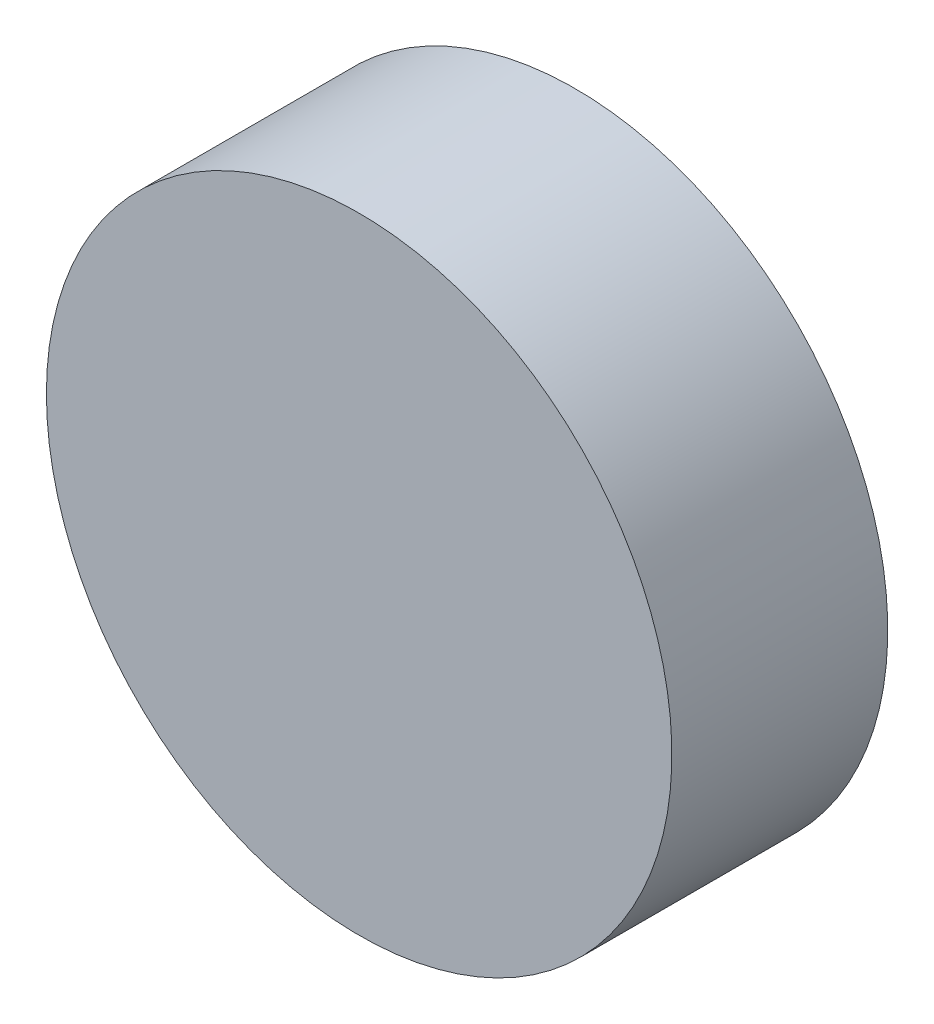
from build123d import *

# Parameters (mm, degrees)
CURVESKETCH_R   = 11.173
CURVEBOSS_DEPTH = 7.713


with BuildPart() as part:
    # CurveSketch → CurveBoss (new body)
    with BuildSketch(Plane.XY):
        with Locations(Location((3.917, -5.139, 0), (0, 0, 180))):
            Circle(CURVESKETCH_R)
    extrude(amount=CURVEBOSS_DEPTH)


solid = part.part
